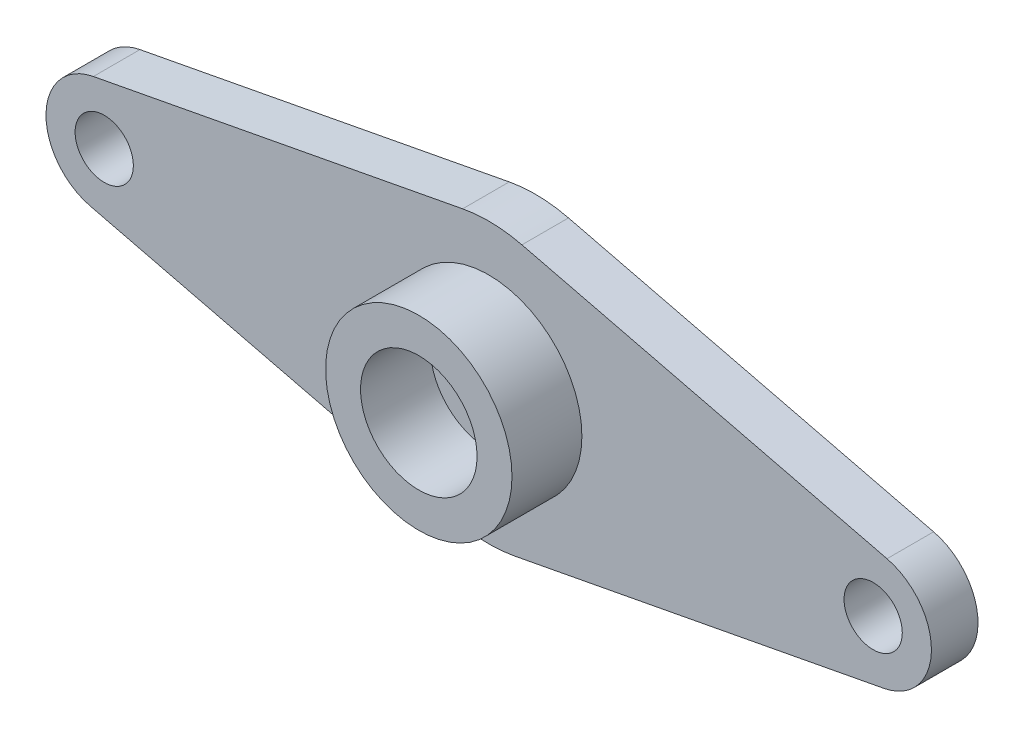
from build123d import *

# Parameters (mm, degrees)
SKETCH1_R           = 1.25
BOSS_EXTRUDE1_DEPTH = 2
SKETCH2_R           = 4
SKETCH2_R_2         = 2.5
BOSS_EXTRUDE2_DEPTH = 3


with BuildPart() as part:
    # Sketch1 → Boss-Extrude1 (new body)
    with BuildSketch(Plane.XY):
        with BuildLine():
            Line((-16.965907586, 2.88879085), (-1.118178206, 5.894885707))
            ThreePointArc((-1.118178206, 5.894885707), (0.157250865, 5.997938993), (1.425527907, 5.828196135))
            Line((1.425527907, 5.828196135), (17.093969961, 1.995826584))
            ThreePointArc((17.093969961, 1.995826584), (18.999141247, -0.498109666), (16.965907586, -2.88879085))
            Line((16.965907586, -2.88879085), (1.118178206, -5.894885707))
            ThreePointArc((1.118178206, -5.894885707), (-0.157250865, -5.997938993), (-1.425527907, -5.828196135))
            Line((-1.425527907, -5.828196135), (-17.093969961, -1.995826584))
            ThreePointArc((-17.093969961, -1.995826584), (-18.999141247, 0.498109666), (-16.965907586, 2.88879085))
        make_face()
        with Locations((-16.5, 0.432588472)):
            Circle(SKETCH1_R, mode=Mode.SUBTRACT)
        with Locations((16.5, -0.432588472)):
            Circle(SKETCH1_R, mode=Mode.SUBTRACT)
        Circle(SKETCH1_R, mode=Mode.SUBTRACT)
    extrude(amount=BOSS_EXTRUDE1_DEPTH)

    # Sketch2 → Boss-Extrude2 (add)
    with BuildSketch(Plane.XY.offset(2)):
        Circle(SKETCH2_R)
        Circle(SKETCH2_R_2, mode=Mode.SUBTRACT)
    extrude(amount=BOSS_EXTRUDE2_DEPTH)


solid = part.part
